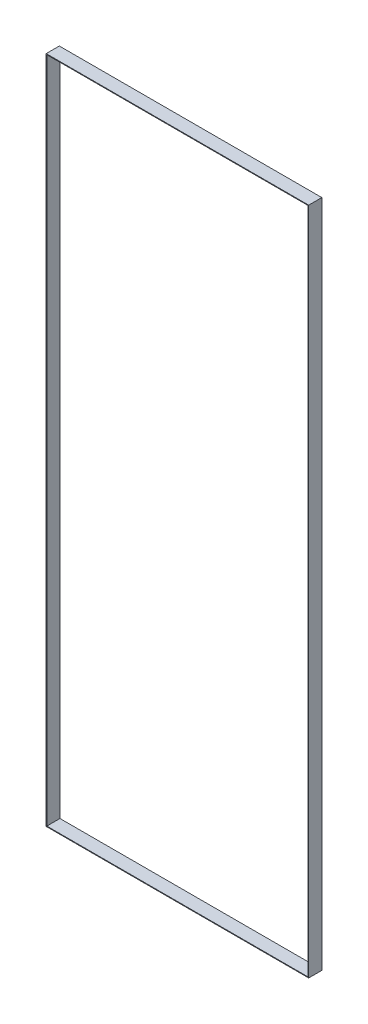
from build123d import *

# Parameters (mm, degrees)
SKETCH3_W           = 400
SKETCH3_H           = 1020
BOSS_EXTRUDE1_DEPTH = 20
SKETCH4_W           = 398
SKETCH4_H           = 1018
CUT_EXTRUDE1_DEPTH  = 20


with BuildPart() as part:
    # Sketch3 → Boss-Extrude1 (new body)
    with BuildSketch(Plane.XY):
        Rectangle(SKETCH3_W, SKETCH3_H)
    extrude(amount=BOSS_EXTRUDE1_DEPTH)

    # Sketch4 → Cut-Extrude1 (cut)
    with BuildSketch(Plane.XY.offset(20)):
        Rectangle(SKETCH4_W, SKETCH4_H)
    extrude(amount=-CUT_EXTRUDE1_DEPTH, mode=Mode.SUBTRACT)


solid = part.part
